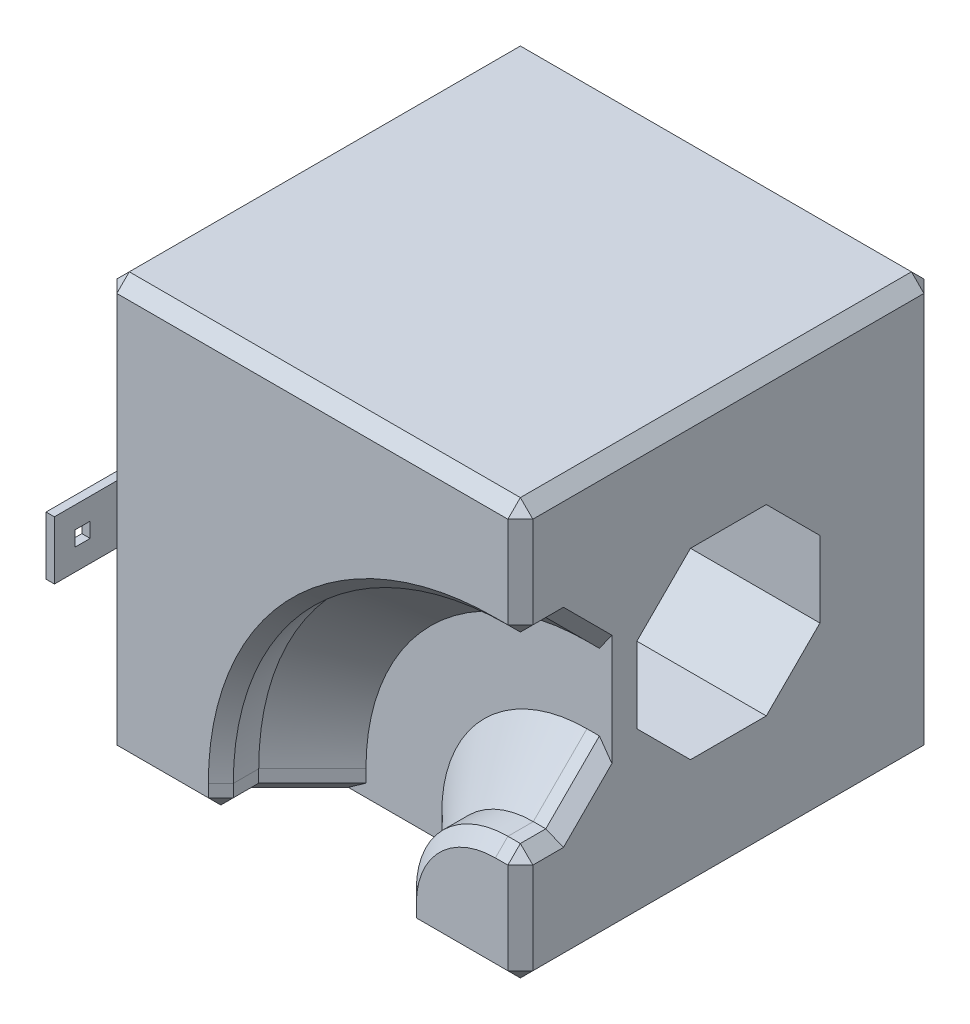
from build123d import *

# Parameters (mm, degrees)
SKETCH1_W                = 50
SKETCH1_H                = 50
BOSS_EXTRUDE1_DEPTH      = 50
CUT_EXTRUDE1_DEPTH       = 87.602540378
CHAMFER3_SIZE            = 1.5
BOSS_EXTRUDE2_DEPTH      = 7
BOSS_EXTRUDE2_DEPTH_BACK = 10
SKETCH5_W                = 1
SKETCH5_H                = 7
SKETCH6_W                = 1.8
SKETCH6_H                = 1.8
CUT_EXTRUDE2_DEPTH       = 7


with BuildPart() as part:
    # Sketch1 → Boss-Extrude1 (new body)
    with BuildSketch(Plane.XY):
        with Locations((25, 25)):
            Rectangle(SKETCH1_W, SKETCH1_H)
    extrude(amount=BOSS_EXTRUDE1_DEPTH)

    # Sketch2 → Cut-Extrude1 (cut, through all)
    with BuildSketch(Plane.ZY):
        Polygon((36, 29.556349186), (29.556349186, 36), (20.443650814, 36), (14, 29.556349186), (14, 20.443650814), (20.443650814, 14), (29.556349186, 14), (36, 20.443650814), align=None)
    extrude(amount=-CUT_EXTRUDE1_DEPTH, mode=Mode.SUBTRACT)

    # Cut-Sweep1: sweep along a path in Sketch4
    with BuildLine(Plane.XY.offset(50)) as cut_sweep1_path:
        Line((25, 0), (25, 3))
        ThreePointArc((25, 3), (31.443650814, 18.556349186), (47, 25))
        Line((47, 25), (50, 25))
    # Sketch3 → Cut-Sweep1 (sweep, cut)
    with BuildSketch(Plane.XZ):
        Polygon((29.556349186, 39), (36, 45.443650814), (36, 54.556349186), (29.556349186, 61), (20.443650814, 61), (14, 54.556349186), (14, 45.443650814), (20.443650814, 39), align=None)
    sweep(path=cut_sweep1_path.line, mode=Mode.SUBTRACT)

    # Chamfer3
    chamfer3_edges = [part.edges().sort_by_distance(p)[0] for p in [
        (50, 7, 50),
        (25, 50, 50),
        (43, 0, 50),
        (50, 43, 50),
        (36, 1.5, 50),
        (39.221825407, 10.778174593, 50),
        (48.5, 14, 50),
        (14, 1.5, 50),
        (23.665476221, 26.334523779, 50),
        (48.5, 36, 50),
        (50, 36, 47.721825407),
        (50, 14, 47.721825407),
        (36, 0, 47.721825407),
        (14, 0, 47.721825407),
        (17.221825407, 0, 42.221825407),
        (32.778174593, 0, 42.221825407),
        (50, 32.778174593, 42.221825407),
        (50, 17.221825407, 42.221825407),
        (0, 25, 50),
        (25, 50, 0),
        (50, 25, 0),
        (25, 0, 0),
        (0, 25, 0),
        (7, 0, 50),
        (0, 50, 25),
        (50, 50, 25),
        (50, 0, 25),
        (0, 0, 25),
    ]]
    chamfer(chamfer3_edges, length=CHAMFER3_SIZE)

    # Sketch5 → Boss-Extrude2 (add, two sides: drawn at the far end of the back side and taken through both)
    with BuildSketch(Plane.XY.offset(50).offset(-BOSS_EXTRUDE2_DEPTH_BACK)):
        with Locations((0.5, 25)):
            Rectangle(SKETCH5_W, SKETCH5_H)
    extrude(amount=BOSS_EXTRUDE2_DEPTH + BOSS_EXTRUDE2_DEPTH_BACK)

    # Sketch6 → Cut-Extrude2 (cut)
    with BuildSketch(Plane(origin=(1, 0, 0), x_dir=(0, 0, -1), z_dir=(1, 0, 0))):
        with Locations((-53.6, 25)):
            Rectangle(SKETCH6_W, SKETCH6_H)
    extrude(amount=-CUT_EXTRUDE2_DEPTH, mode=Mode.SUBTRACT)


solid = part.part
